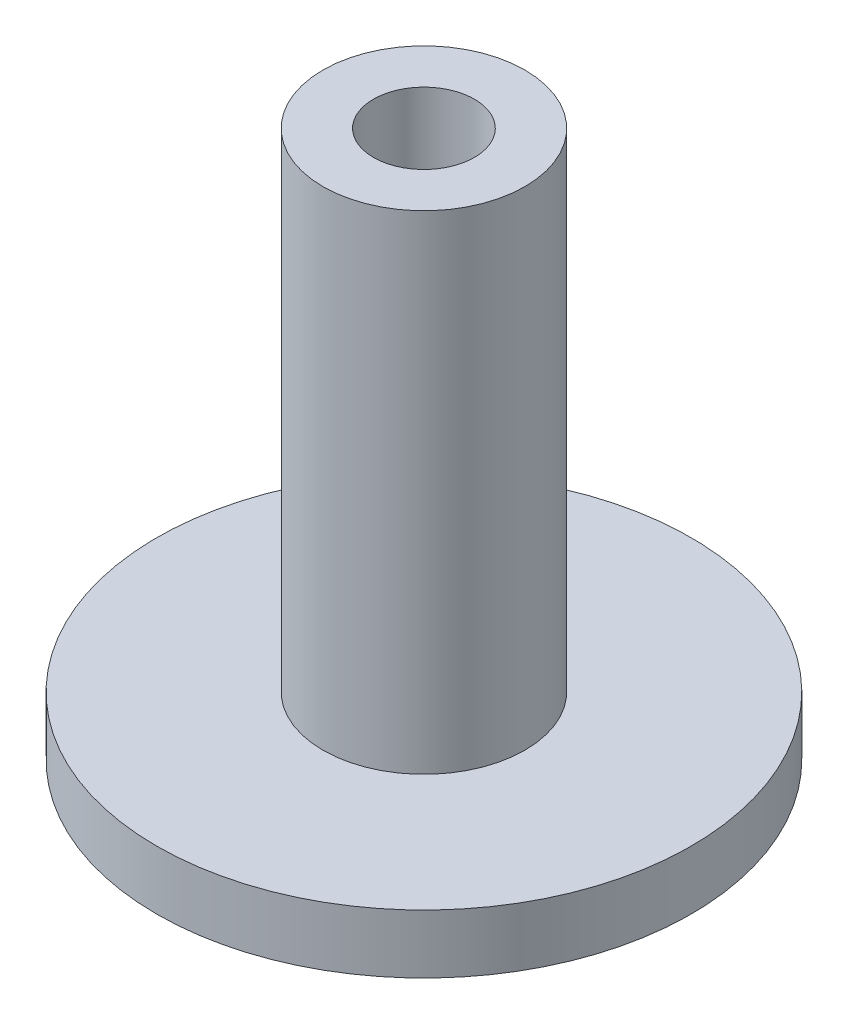
from build123d import *

# Parameters (mm, degrees)
SKETCH1_R           = 6.35
BOSS_EXTRUDE1_DEPTH = 1.4
SKETCH2_R           = 2.4
BOSS_EXTRUDE2_DEPTH = 11.6
SKETCH3_R           = 1.2
CUT_EXTRUDE1_DEPTH  = 16.800158227


with BuildPart() as part:
    # Sketch1 → Boss-Extrude1 (new body)
    with BuildSketch(Plane(origin=(0, 0, 0), x_dir=(1, 0, 0), z_dir=(0, 1, 0))):
        with Locations(Location((0, 0, 0), (0, 0, 270))):
            Circle(SKETCH1_R)
    extrude(amount=BOSS_EXTRUDE1_DEPTH)

    # Sketch2 → Boss-Extrude2 (add)
    with BuildSketch(Plane(origin=(0, 1.4, 0), x_dir=(1, 0, 0), z_dir=(0, 1, 0))):
        with Locations(Location((0, 0, 0), (0, 0, 270))):
            Circle(SKETCH2_R)
    extrude(amount=BOSS_EXTRUDE2_DEPTH)

    # Sketch3 → Cut-Extrude1 (cut, through all)
    with BuildSketch(Plane(origin=(0, 13, 0), x_dir=(1, 0, 0), z_dir=(0, 1, 0))):
        with Locations(Location((0, 0, 0), (0, 0, 270))):
            Circle(SKETCH3_R)
    extrude(amount=-CUT_EXTRUDE1_DEPTH, mode=Mode.SUBTRACT)


solid = part.part
